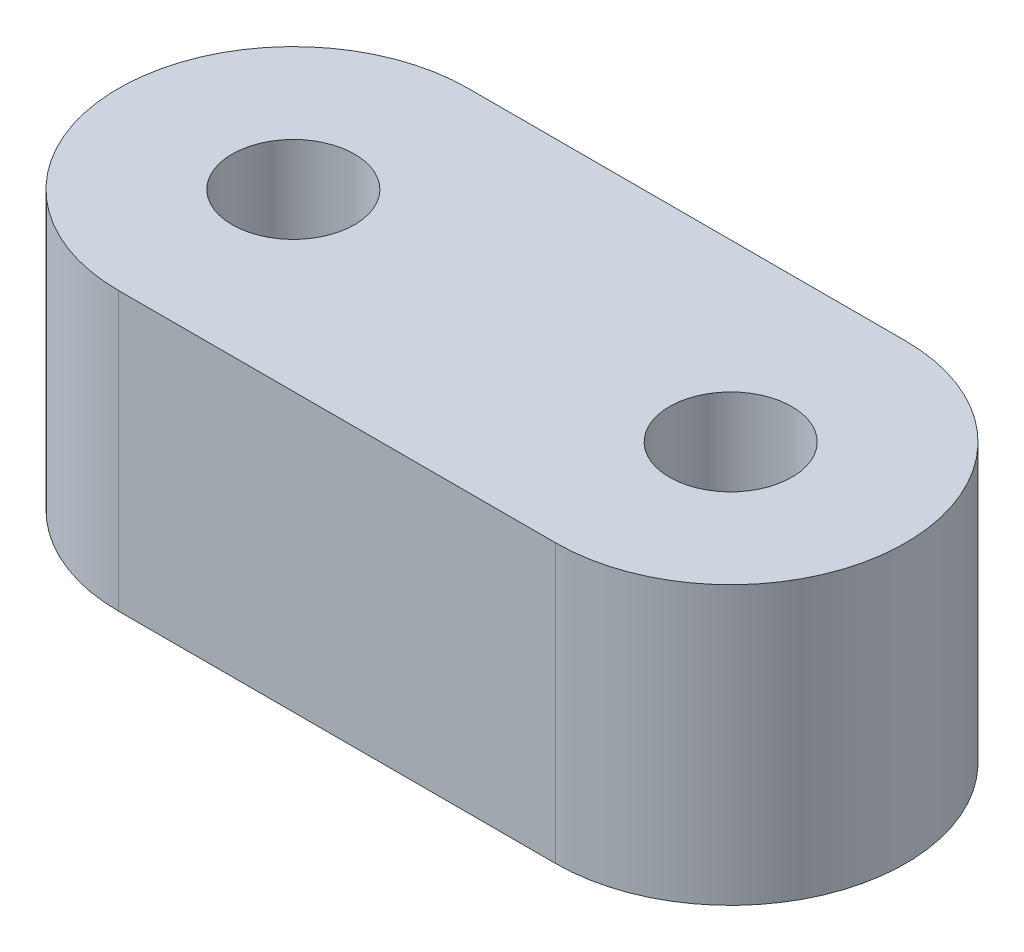
from build123d import *

# Parameters (mm, degrees)
SKETCH1_R           = 1.4
BOSS_EXTRUDE1_DEPTH = 6.35


with BuildPart() as part:
    # Sketch1 → Boss-Extrude1 (new body)
    with BuildSketch(Plane(origin=(0, 0, 0), x_dir=(1, 0, 0), z_dir=(0, 1, 0))):
        with BuildLine():
            Line((5, -4), (-5, -4))
            ThreePointArc((-5, -4), (-9, 0), (-5, 4))
            Line((-5, 4), (5, 4))
            ThreePointArc((5, 4), (9, 0), (5, -4))
        make_face()
        with Locations(Location((-5, 0, 0), (0, 0, 270))):
            Circle(SKETCH1_R, mode=Mode.SUBTRACT)
        with Locations(Location((5, 0, 0), (0, 0, 270))):
            Circle(SKETCH1_R, mode=Mode.SUBTRACT)
    extrude(amount=BOSS_EXTRUDE1_DEPTH)


solid = part.part
